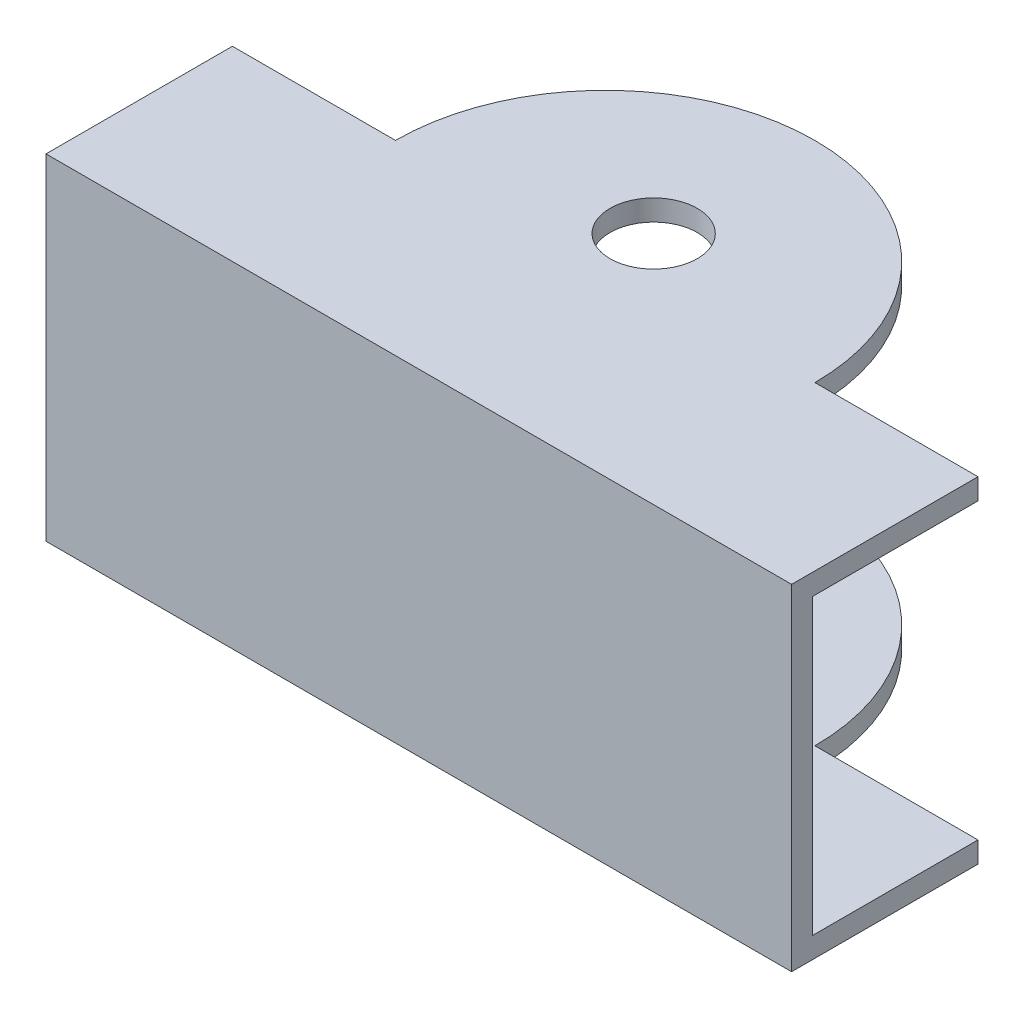
from build123d import *

# Parameters (mm, degrees)
BOSS_EXTRUDE2_DEPTH = 25.4
SKETCH3_W           = 61.065778348
SKETCH3_H           = 22.225
CUT_EXTRUDE2_DEPTH  = 69.777192209
SKETCH4_R           = 3.302
CUT_EXTRUDE3_DEPTH  = 49.382028551


with BuildPart() as part:
    # Sketch1 → Boss-Extrude2 (new body)
    with BuildSketch(Plane(origin=(0, 0, 0), x_dir=(1, 0, 0), z_dir=(0, 1, 0))):
        with BuildLine():
            Line((0, 0), (28.222222222, 0))
            Line((28.222222222, 0), (28.222222222, 14.111111111))
            Line((28.222222222, 14.111111111), (15.875, 14.111111111))
            ThreePointArc((15.875, 14.111111111), (0, 29.986111111), (-15.875, 14.111111111))
            Line((-15.875, 14.111111111), (-28.222222222, 14.111111111))
            Line((-28.222222222, 14.111111111), (-28.222222222, 0))
            Line((-28.222222222, 0), (0, 0))
        make_face()
    extrude(amount=BOSS_EXTRUDE2_DEPTH)

    # Sketch3 → Cut-Extrude2 (cut, through all)
    with BuildSketch(Plane(origin=(28.222222222, 0, 0), x_dir=(0, 0, -1), z_dir=(1, 0, 0))):
        with Locations((32.120389174, 12.7)):
            Rectangle(SKETCH3_W, SKETCH3_H)
    extrude(amount=-CUT_EXTRUDE2_DEPTH, mode=Mode.SUBTRACT)

    # Sketch4 → Cut-Extrude3 (cut, through all)
    with BuildSketch(Plane(origin=(0, 25.4, 0), x_dir=(1, 0, 0), z_dir=(0, 1, 0))):
        with Locations(Location((0, 17.78, 0), (0, 0, 270))):
            Circle(SKETCH4_R)
    extrude(amount=-CUT_EXTRUDE3_DEPTH, mode=Mode.SUBTRACT)


solid = part.part
